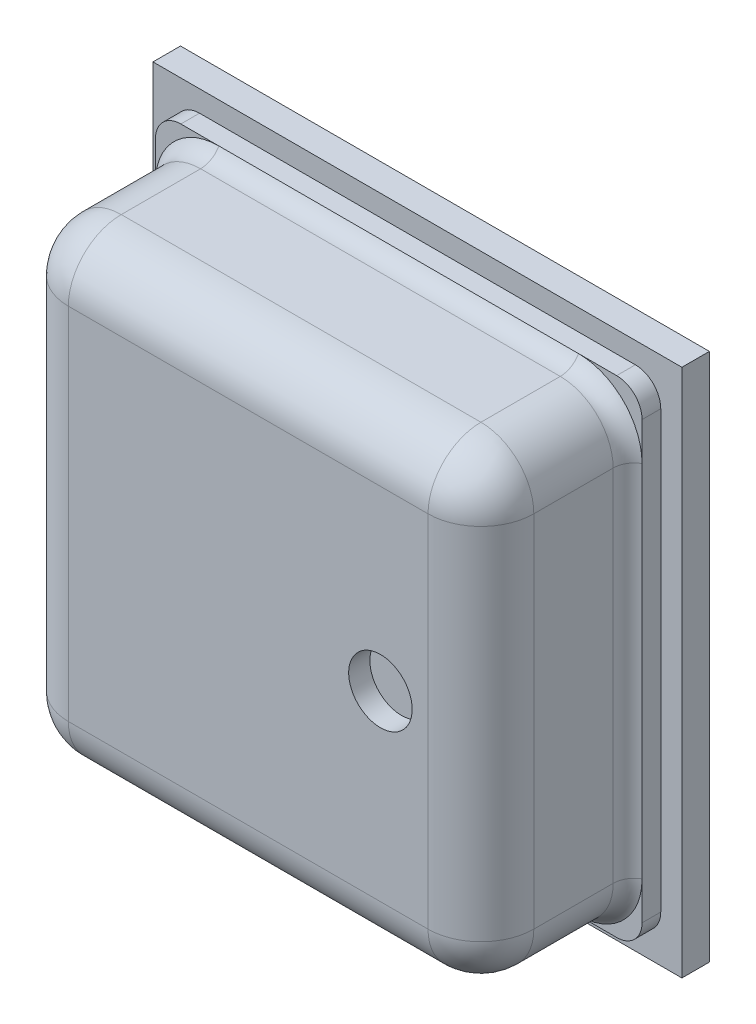
from build123d import *

# Parameters (mm, degrees)
SKETCH_1_W               = 2.5
SKETCH_1_H               = 0.13
EXTRUDE_1_DEPTH          = 1.25
EXTRUDE_2_DEPTH          = 1.25
PATTERN_CIRCULAR_1_COUNT = 2
PATTERN_CIRCULAR_1_ANGLE = 90
SKETCH_2_W               = 0.4
SKETCH_2_H               = 0.4
CUT_EXTRUDE_1_DEPTH      = 2.940360791
CUT_EXTRUDE_2_DEPTH      = 3.614842251
CUT_EXTRUDE_3_DEPTH      = 3.614842251
REVOLVE_1_ANGLE          = 90
REVOLVE_2_ANGLE          = 90
REVOLVE_3_ANGLE          = 90
REVOLVE_4_ANGLE          = 90
EXTRUDE_3_DEPTH          = 0.0884
SKETCH_10_R              = 0.15
CUT_EXTRUDE_4_DEPTH      = 0.8
SKETCH_11_R              = 0.1
EXTRUDE_4_DEPTH          = 0.015
SKETCH_11_W              = 0.35
SKETCH_11_H              = 0.35
EXTRUDE_4_2_DEPTH        = 0.015
EXTRUDE_4_3_DEPTH        = 0.015
EXTRUDE_4_4_DEPTH        = 0.015
EXTRUDE_4_5_DEPTH        = 0.015
EXTRUDE_4_6_DEPTH        = 0.015
EXTRUDE_4_7_DEPTH        = 0.015
EXTRUDE_4_8_DEPTH        = 0.015
EXTRUDE_4_9_DEPTH        = 0.015


with BuildPart() as part:
    # Эскиз1 → Бобышка-Вытянуть1 (new, symmetric)
    with BuildSketch(Plane(origin=(0, 0, 0), x_dir=(1, 0, 0), z_dir=(0, 1, 0))):
        with Locations((0, -0.065)):
            Rectangle(SKETCH_1_W, SKETCH_1_H)
    extrude(amount=EXTRUDE_1_DEPTH, both=True)


with BuildPart() as body_2:
    # Эскиз1<3> → Бобышка-Вытянуть2 (new, symmetric)
    with BuildSketch(Plane(origin=(0, 0, 0), x_dir=(1, 0, 0), z_dir=(0, 1, 0))):
        with BuildLine():
            Line((-1.103175416, -0.13), (-1.15, -0.13))
            Line((-1.15, -0.13), (-1.15, -0.21839746))
            ThreePointArc((-1.15, -0.21839746), (-1.11339746, -0.255), (-1.1, -0.305))
            Line((-1.1, -0.305), (-1.1, -0.68))
            ThreePointArc((-1.1, -0.68), (-1.026776695, -0.856776695), (-0.85, -0.93))
            Line((-0.85, -0.93), (0, -0.93))
            Line((0, -0.93), (0, -0.83))
            Line((0, -0.83), (-0.85, -0.83))
            ThreePointArc((-0.85, -0.83), (-0.956066017, -0.786066017), (-1, -0.68))
            Line((-1, -0.68), (-1, -0.305))
            ThreePointArc((-1, -0.305), (-1.027714022, -0.2034247), (-1.103175416, -0.13))
        make_face()
        with BuildLine():
            Line((1.15, -0.21839746), (1.15, -0.13))
            Line((1.15, -0.13), (1.103175416, -0.13))
            ThreePointArc((1.103175416, -0.13), (1.027714022, -0.2034247), (1, -0.305))
            Line((1, -0.305), (1, -0.68))
            ThreePointArc((1, -0.68), (0.956066017, -0.786066017), (0.85, -0.83))
            Line((0.85, -0.83), (0, -0.83))
            Line((0, -0.83), (0, -0.93))
            Line((0, -0.93), (0.85, -0.93))
            ThreePointArc((0.85, -0.93), (1.026776695, -0.856776695), (1.1, -0.68))
            Line((1.1, -0.68), (1.1, -0.305))
            ThreePointArc((1.1, -0.305), (1.11339746, -0.255), (1.15, -0.21839746))
        make_face()
    extrude(amount=EXTRUDE_2_DEPTH, both=True)


with BuildPart() as pattern_circular_1_1:
    # Круговой массив1: pattern copy
    add(body_2.part.rotate(Axis((0, 0, 0), (0, 0, 1)), 1 * PATTERN_CIRCULAR_1_ANGLE / (PATTERN_CIRCULAR_1_COUNT - 1)))


with BuildPart() as cut_extrude_1_tool:
    # Эскиз2 → Вырез-Вытянуть1 (new, through all)
    with BuildSketch(Plane.XY.offset(0.13)):
        with Locations((-1.05, 1.05)):
            Rectangle(SKETCH_2_W, SKETCH_2_H)
        with Locations((1.05, 1.05)):
            Rectangle(SKETCH_2_W, SKETCH_2_H)
        with Locations((-1.05, -1.05)):
            Rectangle(SKETCH_2_W, SKETCH_2_H)
        with Locations((1.05, -1.05)):
            Rectangle(SKETCH_2_W, SKETCH_2_H)
    extrude(amount=CUT_EXTRUDE_1_DEPTH)


with BuildPart() as body_2_1:
    add(body_2.part)

    # Вырез-Вытянуть1: cut by cut_extrude_1_tool
    add(cut_extrude_1_tool.part, mode=Mode.SUBTRACT)

    # Эскиз4 → Вырез-Вытянуть3 (cut, through all)
    with BuildSketch(Plane(origin=(0.85, 0, 0), x_dir=(0, 0, -1), z_dir=(1, 0, 0))):
        with BuildLine():
            ThreePointArc((-0.83, -1.05), (-0.903606798, -0.961803399), (-0.93, -0.85))
            Line((-0.93, -0.85), (-0.93, -1.25))
            Line((-0.93, -1.25), (-0.83, -1.25))
            Line((-0.83, -1.25), (-0.83, -1.05))
        make_face()
        with BuildLine():
            Line((-0.93, 1.25), (-0.93, 0.85))
            ThreePointArc((-0.93, 0.85), (-0.903606798, 0.961803399), (-0.83, 1.05))
            Line((-0.83, 1.05), (-0.83, 1.25))
            Line((-0.83, 1.25), (-0.93, 1.25))
        make_face()
    extrude(amount=-CUT_EXTRUDE_3_DEPTH, mode=Mode.SUBTRACT)



with BuildPart() as pattern_circular_1_1_1:
    add(pattern_circular_1_1.part)

    # Вырез-Вытянуть1: cut by cut_extrude_1_tool
    add(cut_extrude_1_tool.part, mode=Mode.SUBTRACT)

    # Эскиз3 → Вырез-Вытянуть2 (cut, through all)
    with BuildSketch(Plane.XZ.offset(0.85)):
        with BuildLine():
            ThreePointArc((-1.05, 0.83), (-0.961803399, 0.903606798), (-0.85, 0.93))
            Line((-0.85, 0.93), (-1.25, 0.93))
            Line((-1.25, 0.93), (-1.25, 0.83))
            Line((-1.25, 0.83), (-1.05, 0.83))
        make_face()
        with BuildLine():
            Line((1.25, 0.93), (0.85, 0.93))
            ThreePointArc((0.85, 0.93), (0.961803399, 0.903606798), (1.05, 0.83))
            Line((1.05, 0.83), (1.25, 0.83))
            Line((1.25, 0.83), (1.25, 0.93))
        make_face()
    extrude(amount=-CUT_EXTRUDE_2_DEPTH, mode=Mode.SUBTRACT)


with BuildPart() as body_2_2:
    add(body_2_1.part)

    add(pattern_circular_1_1_1.part)  # Повернуть1 merges Круговой массив1_1
    # Эскиз5 → Повернуть1 (revolve)
    with BuildSketch(Plane(origin=(0.85, 0, 0), x_dir=(0, 0, -1), z_dir=(1, 0, 0))):
        with BuildLine():
            Line((-0.68, 1), (-0.305, 1))
            ThreePointArc((-0.305, 1), (-0.2034247, 1.027714022), (-0.13, 1.103175416))
            Line((-0.13, 1.103175416), (-0.13, 1.15))
            Line((-0.13, 1.15), (-0.21839746, 1.15))
            ThreePointArc((-0.21839746, 1.15), (-0.255, 1.11339746), (-0.305, 1.1))
            Line((-0.305, 1.1), (-0.68, 1.1))
            ThreePointArc((-0.68, 1.1), (-0.856776695, 1.026776695), (-0.93, 0.85))
            Line((-0.93, 0.85), (-0.83, 0.85))
            ThreePointArc((-0.83, 0.85), (-0.786066017, 0.956066017), (-0.68, 1))
        make_face()
    revolve(axis=Axis((0.85, 0.85, 0.93), (0, 0, -1)), revolution_arc=REVOLVE_1_ANGLE)

    # Эскиз6 → Повернуть2 (revolve)
    with BuildSketch(Plane.XZ.offset(0.85)):
        with BuildLine():
            Line((0.85, 0.93), (0.85, 0.83))
            ThreePointArc((0.85, 0.83), (0.956066017, 0.786066017), (1, 0.68))
            Line((1, 0.68), (1, 0.305))
            ThreePointArc((1, 0.305), (1.027714022, 0.2034247), (1.103175416, 0.13))
            Line((1.103175416, 0.13), (1.15, 0.13))
            Line((1.15, 0.13), (1.15, 0.21839746))
            ThreePointArc((1.15, 0.21839746), (1.11339746, 0.255), (1.1, 0.305))
            Line((1.1, 0.305), (1.1, 0.68))
            ThreePointArc((1.1, 0.68), (1.026776695, 0.856776695), (0.85, 0.93))
        make_face()
    revolve(axis=Axis((0.85, -0.85, 0.93), (0, 0, -1)), revolution_arc=REVOLVE_2_ANGLE)

    # Эскиз7 → Повернуть3 (revolve)
    with BuildSketch(Plane.ZY.offset(0.85)):
        with BuildLine():
            Line((0.93, -0.85), (0.83, -0.85))
            ThreePointArc((0.83, -0.85), (0.786066017, -0.956066017), (0.68, -1))
            Line((0.68, -1), (0.305, -1))
            ThreePointArc((0.305, -1), (0.2034247, -1.027714022), (0.13, -1.103175416))
            Line((0.13, -1.103175416), (0.13, -1.15))
            Line((0.13, -1.15), (0.21839746, -1.15))
            ThreePointArc((0.21839746, -1.15), (0.255, -1.11339746), (0.305, -1.1))
            Line((0.305, -1.1), (0.68, -1.1))
            ThreePointArc((0.68, -1.1), (0.856776695, -1.026776695), (0.93, -0.85))
        make_face()
    revolve(axis=Axis((-0.85, -0.85, 0.93), (0, 0, -1)), revolution_arc=REVOLVE_3_ANGLE)

    # Эскиз8 → Повернуть4 (revolve)
    with BuildSketch(Plane(origin=(0, 0.85, 0), x_dir=(1, 0, 0), z_dir=(0, 1, 0))):
        with BuildLine():
            Line((-0.85, -0.93), (-0.85, -0.83))
            ThreePointArc((-0.85, -0.83), (-0.956066017, -0.786066017), (-1, -0.68))
            Line((-1, -0.68), (-1, -0.305))
            ThreePointArc((-1, -0.305), (-1.027714022, -0.2034247), (-1.103175416, -0.13))
            Line((-1.103175416, -0.13), (-1.15, -0.13))
            Line((-1.15, -0.13), (-1.15, -0.21839746))
            ThreePointArc((-1.15, -0.21839746), (-1.11339746, -0.255), (-1.1, -0.305))
            Line((-1.1, -0.305), (-1.1, -0.68))
            ThreePointArc((-1.1, -0.68), (-1.026776695, -0.856776695), (-0.85, -0.93))
        make_face()
    revolve(axis=Axis((-0.85, 0.85, 0.93), (0, 0, -1)), revolution_arc=REVOLVE_4_ANGLE)

    # Эскиз9 → Бобышка-Вытянуть3 (add)
    with BuildSketch(Plane.XY.offset(0.13)):
        with BuildLine():
            Line((-0.85, 1.15), (-1.03, 1.15))
            ThreePointArc((-1.03, 1.15), (-1.114852814, 1.114852814), (-1.15, 1.03))
            Line((-1.15, 1.03), (-1.15, 0.85))
            ThreePointArc((-1.15, 0.85), (-1.062132034, 1.062132034), (-0.85, 1.15))
        make_face()
        with BuildLine():
            Line((1.03, 1.15), (0.85, 1.15))
            ThreePointArc((0.85, 1.15), (1.062132034, 1.062132034), (1.15, 0.85))
            Line((1.15, 0.85), (1.15, 1.03))
            ThreePointArc((1.15, 1.03), (1.114852814, 1.114852814), (1.03, 1.15))
        make_face()
        with BuildLine():
            ThreePointArc((-0.85, -1.15), (-1.062132034, -1.062132034), (-1.15, -0.85))
            Line((-1.15, -0.85), (-1.15, -1.03))
            ThreePointArc((-1.15, -1.03), (-1.114852814, -1.114852814), (-1.03, -1.15))
            Line((-1.03, -1.15), (-0.85, -1.15))
        make_face()
        with BuildLine():
            Line((1.15, -1.03), (1.15, -0.85))
            ThreePointArc((1.15, -0.85), (1.062132034, -1.062132034), (0.85, -1.15))
            Line((0.85, -1.15), (1.03, -1.15))
            ThreePointArc((1.03, -1.15), (1.114852814, -1.114852814), (1.15, -1.03))
        make_face()
    extrude(amount=EXTRUDE_3_DEPTH)

    # Эскиз10 → Вырез-Вытянуть4 (cut)
    with BuildSketch(Plane.XY.offset(0.93)):
        with Locations((0.625, 0.012)):
            Circle(SKETCH_10_R)
    extrude(amount=-CUT_EXTRUDE_4_DEPTH, mode=Mode.SUBTRACT)


with BuildPart() as body_3:
    # Эскиз11 → Бобышка-Вытянуть4 (new body)
    with BuildSketch(Plane(origin=(0, 0, 0), x_dir=(-1, 0, 0), z_dir=(0, 0, -1))):
        with Locations((0.975, 0.5)):
            Circle(SKETCH_11_R)
    extrude(amount=EXTRUDE_4_DEPTH)


with BuildPart() as body_4:
    # Эскиз11 → Extrude 4 2 (new body)
    with BuildSketch(Plane(origin=(0, 0, 0), x_dir=(-1, 0, 0), z_dir=(0, 0, -1))):
        with Locations((-0.975, 0.975)):
            Rectangle(SKETCH_11_W, SKETCH_11_H)
    extrude(amount=EXTRUDE_4_2_DEPTH)


with BuildPart() as body_5:
    # Эскиз11 → Extrude 4 3 (new body)
    with BuildSketch(Plane(origin=(0, 0, 0), x_dir=(-1, 0, 0), z_dir=(0, 0, -1))):
        with Locations((-0.325, 0.975)):
            Rectangle(SKETCH_11_W, SKETCH_11_H)
    extrude(amount=EXTRUDE_4_3_DEPTH)


with BuildPart() as body_6:
    # Эскиз11 → Extrude 4 4 (new body)
    with BuildSketch(Plane(origin=(0, 0, 0), x_dir=(-1, 0, 0), z_dir=(0, 0, -1))):
        with Locations((0.325, 0.975)):
            Rectangle(SKETCH_11_W, SKETCH_11_H)
    extrude(amount=EXTRUDE_4_4_DEPTH)


with BuildPart() as body_7:
    # Эскиз11 → Extrude 4 5 (new body)
    with BuildSketch(Plane(origin=(0, 0, 0), x_dir=(-1, 0, 0), z_dir=(0, 0, -1))):
        with Locations((0.975, 0.975)):
            Rectangle(SKETCH_11_W, SKETCH_11_H)
    extrude(amount=EXTRUDE_4_5_DEPTH)


with BuildPart() as body_8:
    # Эскиз11 → Extrude 4 6 (new body)
    with BuildSketch(Plane(origin=(0, 0, 0), x_dir=(-1, 0, 0), z_dir=(0, 0, -1))):
        with Locations((-0.975, -0.975)):
            Rectangle(SKETCH_11_W, SKETCH_11_H)
    extrude(amount=EXTRUDE_4_6_DEPTH)


with BuildPart() as body_9:
    # Эскиз11 → Extrude 4 7 (new body)
    with BuildSketch(Plane(origin=(0, 0, 0), x_dir=(-1, 0, 0), z_dir=(0, 0, -1))):
        with Locations((-0.325, -0.975)):
            Rectangle(SKETCH_11_W, SKETCH_11_H)
    extrude(amount=EXTRUDE_4_7_DEPTH)


with BuildPart() as body_10:
    # Эскиз11 → Extrude 4 8 (new body)
    with BuildSketch(Plane(origin=(0, 0, 0), x_dir=(-1, 0, 0), z_dir=(0, 0, -1))):
        with Locations((0.325, -0.975)):
            Rectangle(SKETCH_11_W, SKETCH_11_H)
    extrude(amount=EXTRUDE_4_8_DEPTH)


with BuildPart() as body_11:
    # Эскиз11 → Extrude 4 9 (new body)
    with BuildSketch(Plane(origin=(0, 0, 0), x_dir=(-1, 0, 0), z_dir=(0, 0, -1))):
        with Locations((0.975, -0.975)):
            Rectangle(SKETCH_11_W, SKETCH_11_H)
    extrude(amount=EXTRUDE_4_9_DEPTH)


solid = Compound([part.part, body_2_2.part, body_3.part, body_4.part, body_5.part, body_6.part, body_7.part, body_8.part, body_9.part, body_10.part, body_11.part])
